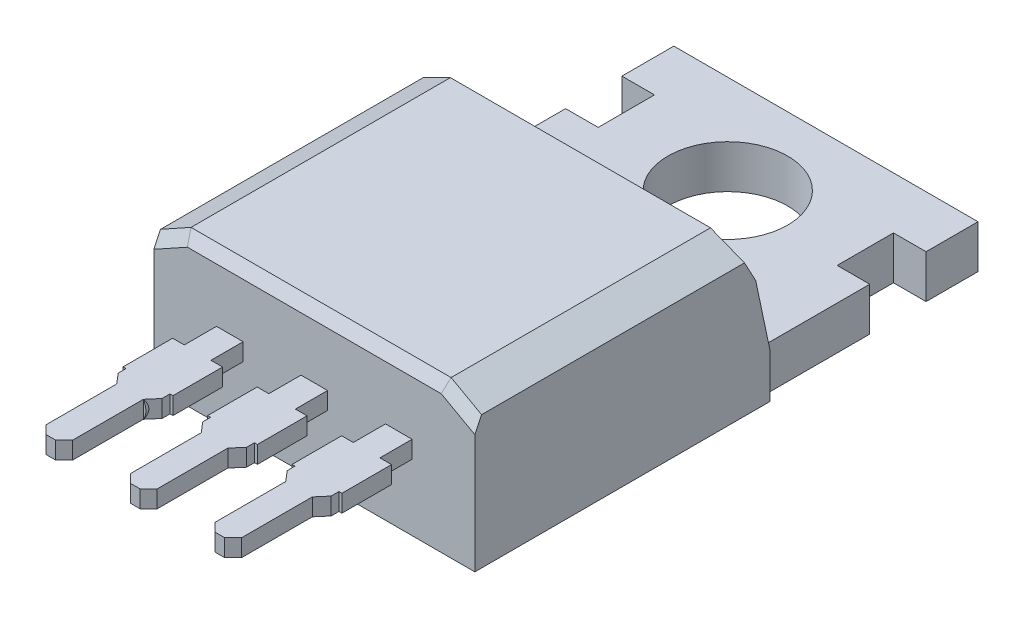
from build123d import *
from OCP.BRepFilletAPI import BRepFilletAPI_MakeChamfer

# Parameters (mm, degrees)
EXTRUDE1_DEPTH      = 4.826
EXTRUDE1_DEPTH_BACK = 4.826
SKETCH10_R          = 1.8
SKETCH10_W          = 1.233836604
SKETCH10_H          = 1.6931216
EXTRUDE5_DEPTH      = 16.428369203
SKETCH6_W           = 0.8
SKETCH6_H           = 0.52
EXTRUDE6_DEPTH      = 5.38
EXTRUDE7_START      = -0.52
EXTRUDE7_DEPTH      = 0.52
CHAMFER1_SIZE       = 0.254
SKETCH12_W          = 7.379682426
SKETCH12_H          = 2.736118788
EXTRUDE8_DEPTH      = 0.254
SKETCH13_W          = 7.379682426
SKETCH13_H          = 2.736118788
EXTRUDE9_DEPTH      = 0.254
CHAMFER2_SIZE       = 0.508
CHAMFER2_SIZE2      = 0.91645626
CHAMFER3_SIZE       = 0.2032
CHAMFER3_SIZE2      = 0.366582504
CHAMFER3_SIZE2_2    = 0.605677555
CHAMFER3_SIZE2_3    = 0.557834937
EXTRUDE10_DEPTH     = 1.016


with BuildPart() as part:
    # Sketch2 → Extrude1 (new, two sides: drawn at the far end of the back side and taken through both)
    with BuildSketch(Plane(origin=(0, 0, 0), x_dir=(0, 0, -1), z_dir=(1, 0, 0)).offset(-EXTRUDE1_DEPTH_BACK)):
        Polygon((14.3005, 0), (-1.0795, 0), (-1.0795, 4.5), (7.124012877, 4.5), (7.8005, 1.3), (14.3005, 1.3), align=None)
    extrude(amount=EXTRUDE1_DEPTH + EXTRUDE1_DEPTH_BACK)

    # Sketch10 → Extrude5 (cut, through all)
    with BuildSketch(Plane(origin=(0, 1.3, 0), x_dir=(1, 0, 0), z_dir=(0, 1, 0))):
        with Locations(Location((0, 11.3505, 0), (0, 0, 270))):
            Circle(SKETCH10_R)
        with Locations((-4.209081698, 11.892729701)):
            Rectangle(SKETCH10_W, SKETCH10_H)
        with Locations((4.209081698, 11.892729701)):
            Rectangle(SKETCH10_W, SKETCH10_H)
    extrude(amount=-EXTRUDE5_DEPTH, mode=Mode.SUBTRACT)

    # Sketch6 → Extrude6 (add)
    with BuildSketch(Plane.XY.offset(1.0795)):
        with Locations((2.54, 2.25)):
            Rectangle(SKETCH6_W, SKETCH6_H)
        with Locations((-2.54, 2.25)):
            Rectangle(SKETCH6_W, SKETCH6_H)
        with Locations((0, 2.25)):
            Rectangle(SKETCH6_W, SKETCH6_H)
    extrude(amount=EXTRUDE6_DEPTH)

    # Sketch11 → Extrude7 (add)
    with BuildSketch(Plane(origin=(0, 2.51, 0), x_dir=(1, 0, 0), z_dir=(0, 1, 0)).offset(EXTRUDE7_START)):
        Polygon((-2.94, -2.0475), (-3.29, -2.0475), (-3.29, -3.5395), (-3.2004, -3.5395), (-3.2004, -3.7747), (-2.94, -4.0795), align=None)
        Polygon((-1.79, -2.0475), (-2.14, -2.0475), (-2.14, -4.0795), (-1.8796, -3.7747), (-1.8796, -3.5395), (-1.79, -3.5395), align=None)
        Polygon((-0.4, -2.0475), (-0.75, -2.0475), (-0.75, -3.5395), (-0.6604, -3.5395), (-0.6604, -3.7747), (-0.4, -4.0795), align=None)
        Polygon((0.75, -2.0475), (0.4, -2.0475), (0.4, -4.0795), (0.6604, -3.7747), (0.6604, -3.5395), (0.75, -3.5395), align=None)
        Polygon((2.14, -2.0475), (1.79, -2.0475), (1.79, -3.5395), (1.8796, -3.5395), (1.8796, -3.7747), (2.14, -4.0795), align=None)
        Polygon((3.29, -2.0475), (2.94, -2.0475), (2.94, -4.0795), (3.2004, -3.7747), (3.2004, -3.5395), (3.29, -3.5395), align=None)
    extrude(amount=EXTRUDE7_DEPTH)

    # Chamfer1
    chamfer1_edges = [part.edges().sort_by_distance(p)[0] for p in [
        (-2.14, 2.25, 6.4595),
        (-2.94, 2.25, 6.4595),
        (2.94, 2.25, 6.4595),
        (2.14, 2.25, 6.4595),
        (0.4, 2.25, 6.4595),
        (-0.4, 2.25, 6.4595),
    ]]
    chamfer(chamfer1_edges, length=CHAMFER1_SIZE)

    # Sketch12 → Extrude8 (cut)
    with BuildSketch(Plane.ZY.offset(4.826)):
        with Locations((-11.490341213, 1.368059394)):
            Rectangle(SKETCH12_W, SKETCH12_H)
    extrude(amount=-EXTRUDE8_DEPTH, mode=Mode.SUBTRACT)

    # Sketch13 → Extrude9 (cut)
    with BuildSketch(Plane(origin=(4.826, 0, 0), x_dir=(0, 0, -1), z_dir=(1, 0, 0))):
        with Locations((11.490341213, 1.368059394)):
            Rectangle(SKETCH13_W, SKETCH13_H)
    extrude(amount=-EXTRUDE9_DEPTH, mode=Mode.SUBTRACT)

    # Chamfer2: one chamfer whose edges measure the first distance from different faces: ONE call of the kernel's chamfer builder (chamfer() names one face for all edges)
    chamfer2_edges_1 = [part.edges().sort_by_distance(p)[0] for p in [
        (-4.826, 4.5, -3.022256439),
    ]]
    chamfer2_side_1 = [part.faces().sort_by_distance(p)[0] for p in [
        (-4.826, 2.217055195, -3.243165334),
    ]]
    chamfer2_edges_2 = [part.edges().sort_by_distance(p)[0] for p in [
        (4.826, 4.5, -3.022256439),
    ]]
    chamfer2_side_2 = [part.faces().sort_by_distance(p)[0] for p in [
        (4.826, 2.217055195, -3.243165334),
    ]]
    chamfer2 = BRepFilletAPI_MakeChamfer(part.part.solid().wrapped)
    for e in chamfer2_edges_1:
        chamfer2.Add(CHAMFER2_SIZE, CHAMFER2_SIZE2, e.wrapped, chamfer2_side_1[0].wrapped)  # the first distance lies on this face
    for e in chamfer2_edges_2:
        chamfer2.Add(CHAMFER2_SIZE, CHAMFER2_SIZE2, e.wrapped, chamfer2_side_2[0].wrapped)  # the first distance lies on this face
    add(Compound.cast(chamfer2.Shape()), mode=Mode.REPLACE)

    # Chamfer3: one chamfer whose edges measure the first distance from different faces: ONE call of the kernel's chamfer builder (chamfer() names one face for all edges)
    chamfer3_edges_1 = [part.edges().sort_by_distance(p)[0] for p in [
        (0, 4.5, 1.0795),
    ]]
    chamfer3_side_1 = [part.faces().sort_by_distance(p)[0] for p in [
        (0, 4.5, -3.022256439),
    ]]
    chamfer3_edges_2 = [part.edges().sort_by_distance(p)[0] for p in [
        (-4.36777187, 4.246, 1.0795),
    ]]
    chamfer3_side_2 = [part.faces().sort_by_distance(p)[0] for p in [
        (-4.368765147, 4.245449417, -3.049162718),
    ]]
    chamfer3_edges_3 = [part.edges().sort_by_distance(p)[0] for p in [
        (4.36777187, 4.246, 1.0795),
    ]]
    chamfer3_side_3 = [part.faces().sort_by_distance(p)[0] for p in [
        (4.368765147, 4.245449417, -3.049162718),
    ]]
    chamfer3_edges_4 = [part.edges().sort_by_distance(p)[0] for p in [
        (0, 4.5, -7.124012877),
    ]]
    chamfer3_side_4 = [part.faces().sort_by_distance(p)[0] for p in [
        (0, 4.5, -3.022256439),
    ]]
    chamfer3_edges_5 = [part.edges().sort_by_distance(p)[0] for p in [
        (-4.36777187, 4.246, -7.177709043),
    ]]
    chamfer3_side_5 = [part.faces().sort_by_distance(p)[0] for p in [
        (-4.368765147, 4.245449417, -3.049162718),
    ]]
    chamfer3_edges_6 = [part.edges().sort_by_distance(p)[0] for p in [
        (4.36777187, 4.246, -7.177709043),
    ]]
    chamfer3_side_6 = [part.faces().sort_by_distance(p)[0] for p in [
        (4.368765147, 4.245449417, -3.049162718),
    ]]
    chamfer3 = BRepFilletAPI_MakeChamfer(part.part.solid().wrapped)
    for e in chamfer3_edges_1:
        chamfer3.Add(CHAMFER3_SIZE, CHAMFER3_SIZE2, e.wrapped, chamfer3_side_1[0].wrapped)  # the first distance lies on this face
    for e in chamfer3_edges_2:
        chamfer3.Add(CHAMFER3_SIZE, CHAMFER3_SIZE2, e.wrapped, chamfer3_side_2[0].wrapped)  # the first distance lies on this face
    for e in chamfer3_edges_3:
        chamfer3.Add(CHAMFER3_SIZE, CHAMFER3_SIZE2, e.wrapped, chamfer3_side_3[0].wrapped)  # the first distance lies on this face
    for e in chamfer3_edges_4:
        chamfer3.Add(CHAMFER3_SIZE, CHAMFER3_SIZE2_2, e.wrapped, chamfer3_side_4[0].wrapped)  # the first distance lies on this face
    for e in chamfer3_edges_5:
        chamfer3.Add(CHAMFER3_SIZE, CHAMFER3_SIZE2_3, e.wrapped, chamfer3_side_5[0].wrapped)  # the first distance lies on this face
    for e in chamfer3_edges_6:
        chamfer3.Add(CHAMFER3_SIZE, CHAMFER3_SIZE2_3, e.wrapped, chamfer3_side_6[0].wrapped)  # the first distance lies on this face
    add(Compound.cast(chamfer3.Shape()), mode=Mode.REPLACE)

    # Sketch15 → Extrude10 (add)
    with BuildSketch(Plane.XY.offset(4.0795)):
        with BuildLine():
            Line((-2.14, 2.51), (-2.94, 2.51))
            ThreePointArc((-2.94, 2.51), (-3.017074418, 2.25), (-2.94, 1.99))
            Line((-2.94, 1.99), (-2.14, 1.99))
            ThreePointArc((-2.14, 1.99), (-2.062925582, 2.25), (-2.14, 2.51))
        make_face()
    extrude(amount=-EXTRUDE10_DEPTH)


solid = part.part
